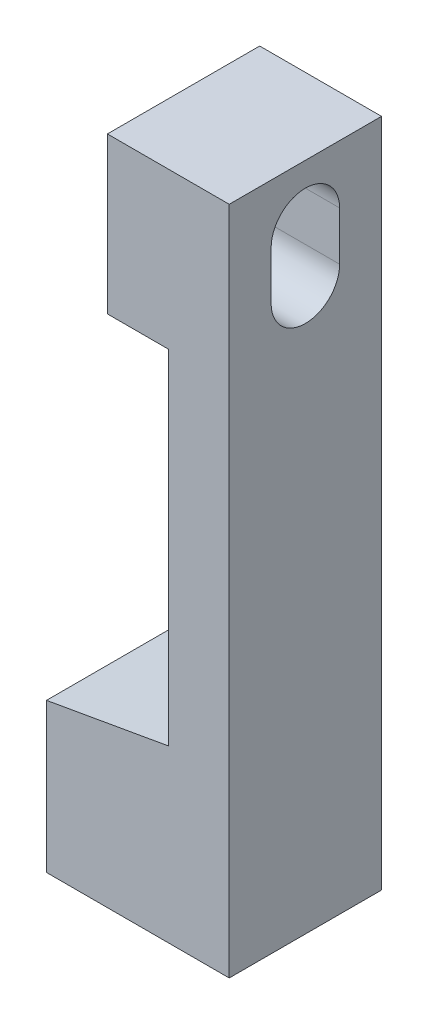
from build123d import *

# Parameters (mm, degrees)
SKETCH1_W           = 15.875
SKETCH1_H           = 69.85
BOSS_EXTRUDE1_DEPTH = 6.35
BOSS_EXTRUDE2_DEPTH = 6.35
BOSS_EXTRUDE3_DEPTH = 12.7
CUT_EXTRUDE1_DEPTH  = 41.411152545
CUT_EXTRUDE2_DEPTH  = 41.566760177


with BuildPart() as part:
    # Sketch1 → Boss-Extrude1 (new body)
    with BuildSketch(Plane(origin=(0, 0, 0), x_dir=(0, 0, -1), z_dir=(1, 0, 0))):
        Rectangle(SKETCH1_W, SKETCH1_H)
    extrude(amount=BOSS_EXTRUDE1_DEPTH)

    # Sketch2 → Boss-Extrude2 (add)
    with BuildSketch(Plane.ZY):
        Polygon((7.9375, 34.925), (-7.9375, 34.925), (-7.9375, 15.875), (7.9375, 18.674190819), align=None)
    extrude(amount=BOSS_EXTRUDE2_DEPTH)

    # Sketch3 → Boss-Extrude3 (add)
    with BuildSketch(Plane.ZY):
        Polygon((-7.9375, -19.944190819), (-7.9375, -34.925), (7.9375, -34.925), (7.9375, -17.145), align=None)
    extrude(amount=BOSS_EXTRUDE3_DEPTH)

    # Sketch6 → Cut-Extrude1 (cut, through all)
    with BuildSketch(Plane(origin=(0, 0, -7.9375), x_dir=(-1, 0, 0), z_dir=(0, 0, -1))):
        Polygon((0, -17.145), (12.7, -17.145), (12.7, -19.384352655), align=None)
    extrude(amount=-CUT_EXTRUDE1_DEPTH, mode=Mode.SUBTRACT)

    # Sketch7 → Cut-Extrude2 (cut, through all)
    with BuildSketch(Plane(origin=(6.35, 0, 0), x_dir=(0, 0, -1), z_dir=(1, 0, 0))):
        with BuildLine():
            Line((3.5687, 28.841737989), (3.5687, 23.761737989))
            ThreePointArc((3.5687, 23.761737989), (0, 20.193037989), (-3.5687, 23.761737989))
            Line((-3.5687, 23.761737989), (-3.5687, 28.841737989))
            ThreePointArc((-3.5687, 28.841737989), (0, 32.410437989), (3.5687, 28.841737989))
        make_face()
    extrude(amount=-CUT_EXTRUDE2_DEPTH, mode=Mode.SUBTRACT)


solid = part.part
